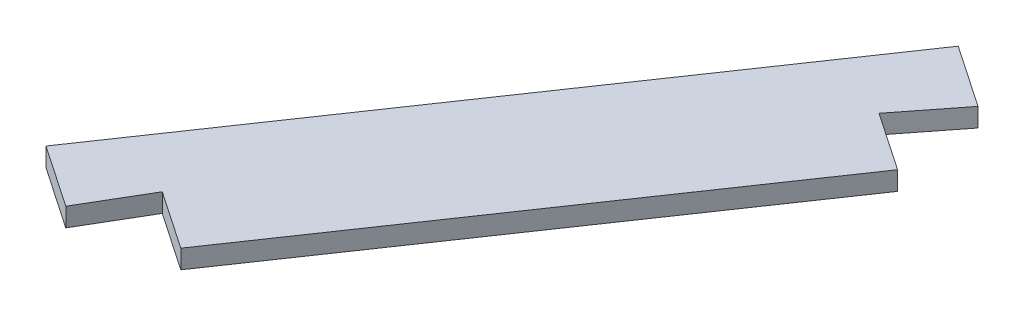
from build123d import *

# Parameters (mm, degrees)
BOSS_EXTRUDE1_DEPTH = 4


with BuildPart() as part:
    # Sketch4 → Boss-Extrude1 (new body)
    with BuildSketch(Plane(origin=(0, 0, 0), x_dir=(1, 0, 0), z_dir=(0, 1, 0))):
        Polygon((139.51034, -2.930047082), (201.440430451, 87.980149797), (189.043585422, 96.425162132), (198.315054091, 108.259006338), (185.091752727, 117.267019495), (176.646740392, 104.870174466), (114.716649942, 13.959977586), (106.271637607, 1.563132557), (119.494938972, -7.4448806), (127.113494971, 5.514965252), align=None)
    extrude(amount=BOSS_EXTRUDE1_DEPTH)


solid = part.part
